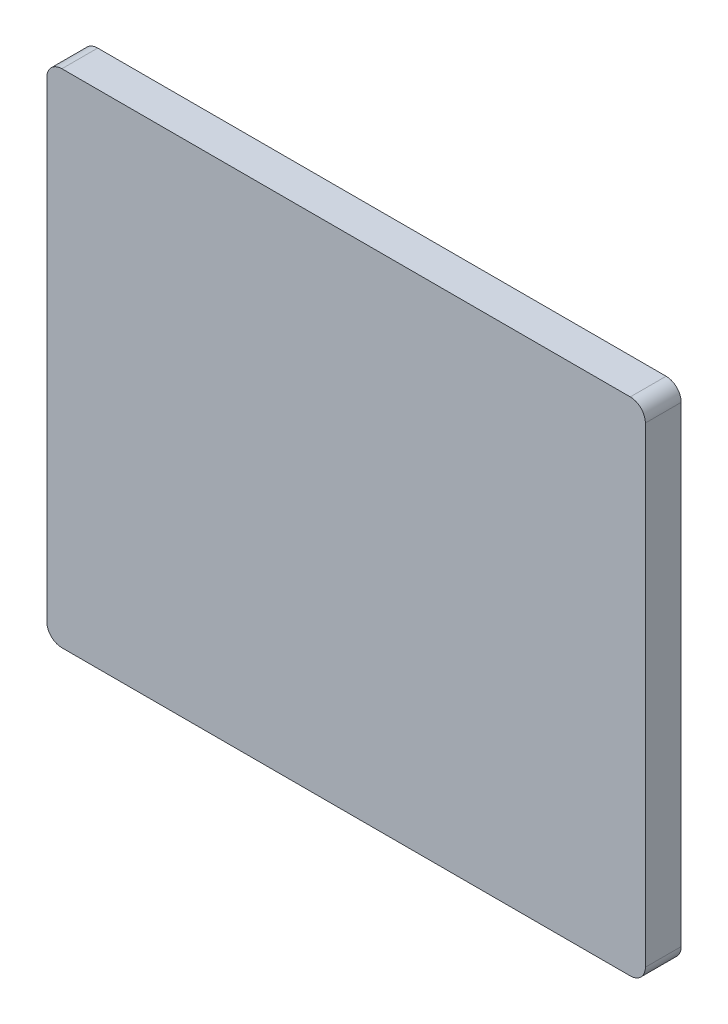
from build123d import *

# Parameters (mm, degrees)
SKETCH1_W           = 31.75
SKETCH1_H           = 26.6
BOSS_EXTRUDE1_DEPTH = 1.9
FILLET1_R           = 0.8


with BuildPart() as part:
    # Sketch1 → Boss-Extrude1 (new body)
    with BuildSketch(Plane.XY):
        Rectangle(SKETCH1_W, SKETCH1_H)
    extrude(amount=BOSS_EXTRUDE1_DEPTH)

    # Fillet1
    fillet1_edges = [part.edges().sort_by_distance(p)[0] for p in [
        (-15.875, 13.3, 0.95),
        (15.875, 13.3, 0.95),
        (15.875, -13.3, 0.95),
        (-15.875, -13.3, 0.95),
    ]]
    fillet(fillet1_edges, radius=FILLET1_R)


solid = part.part
